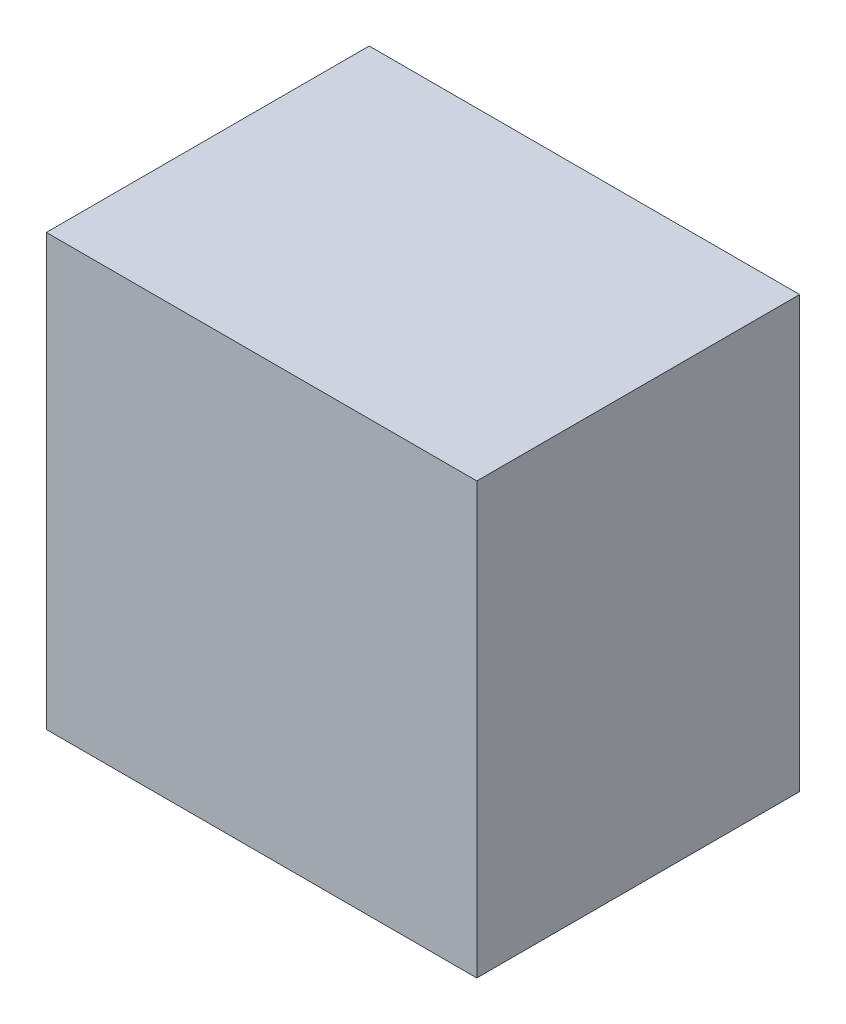
from build123d import *

# Parameters (mm, degrees)
BOSS_EXTRUDE1_DEPTH      = 15
BOSS_EXTRUDE1_DEPTH_BACK = 15
SKETCH1_W                = 40
SKETCH1_H                = 40
CUT_EXTRUDE1_DEPTH       = 12
CUT_EXTRUDE1_DEPTH_BACK  = 5
SKETCH2_W                = 10
SKETCH2_H                = 10


with BuildPart() as part:
    # Sketch1 → Boss-Extrude1 (new, two sides: drawn at the far end of the back side and taken through both)
    with BuildSketch(Plane.XY.offset(-BOSS_EXTRUDE1_DEPTH_BACK)):
        with Locations((20, 20)):
            Rectangle(SKETCH1_W, SKETCH1_H)
    extrude(amount=BOSS_EXTRUDE1_DEPTH + BOSS_EXTRUDE1_DEPTH_BACK)

    # Sketch2 → Cut-Extrude1 (cut, two sides: drawn at the far end of the back side and taken through both)
    with BuildSketch(Plane.XY.offset(-CUT_EXTRUDE1_DEPTH_BACK)):
        with Locations((5, 5)):
            Rectangle(SKETCH2_W, SKETCH2_H)
    extrude(amount=CUT_EXTRUDE1_DEPTH + CUT_EXTRUDE1_DEPTH_BACK, mode=Mode.SUBTRACT)


solid = part.part
